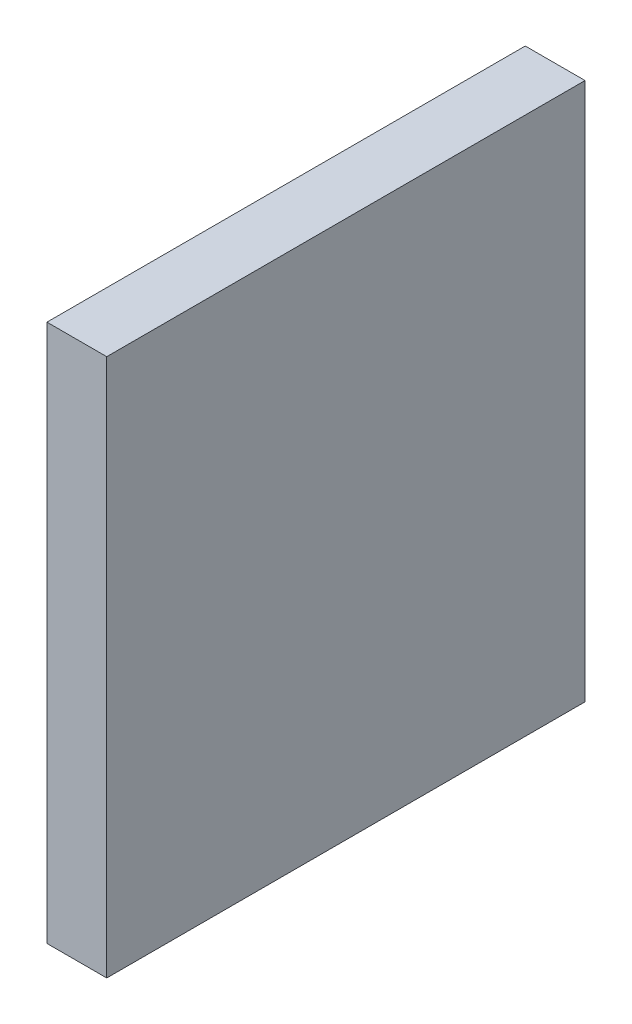
from build123d import *

# Parameters (mm, degrees)
SKETCH1_W           = 12.7
SKETCH1_H           = 101.6
BOSS_EXTRUDE1_DEPTH = 114.3


with BuildPart() as part:
    # Sketch1 → Boss-Extrude1 (new body)
    with BuildSketch(Plane(origin=(0, 0, 0), x_dir=(1, 0, 0), z_dir=(0, 1, 0))):
        with Locations((6.35, 50.8)):
            Rectangle(SKETCH1_W, SKETCH1_H)
    extrude(amount=BOSS_EXTRUDE1_DEPTH)


solid = part.part
